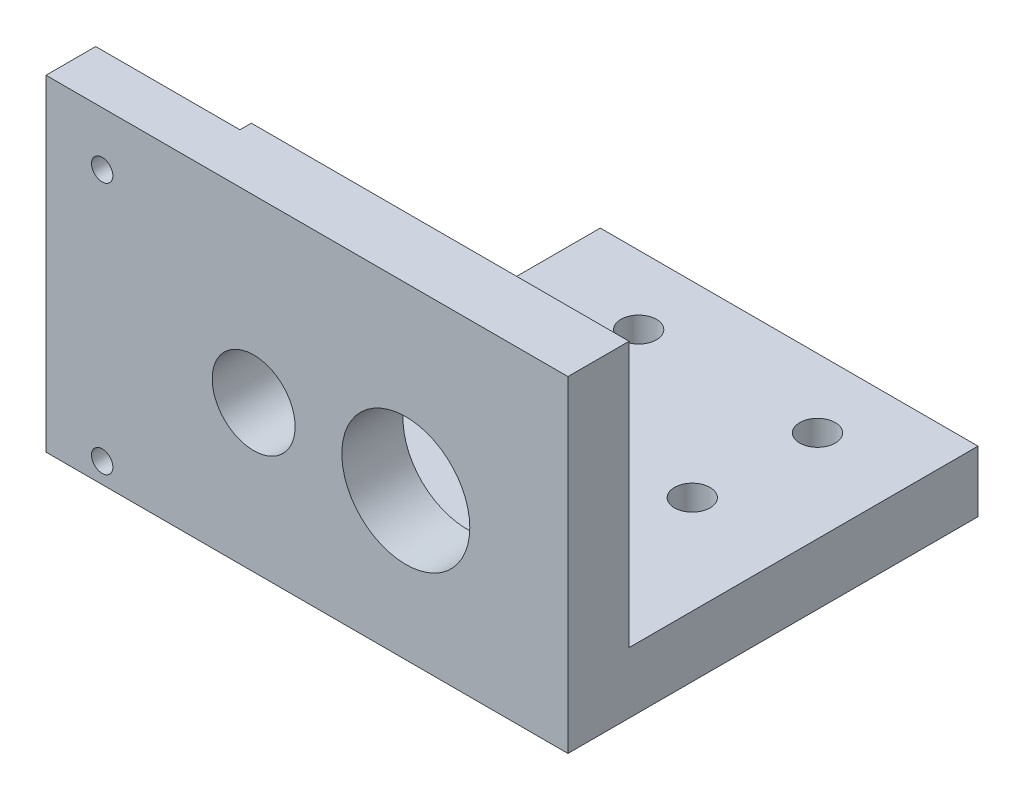
from build123d import *

# Parameters (mm, degrees)
EXTRUDE_THIN1_DEPTH = 36.7
SKETCH4_W           = 21.133468013
SKETCH4_H           = 40.04871341
CUT_EXTRUDE2_DEPTH  = 54.616609778
SKETCH5_R           = 4.5
CUT_EXTRUDE3_DEPTH  = 54.616609778
SKETCH6_R           = 2.915
CUT_EXTRUDE4_DEPTH  = 54.616609778
SKETCH7_R           = 0.75
CUT_EXTRUDE5_DEPTH  = 54.616609778
SKETCH8_R           = 1.25
CUT_EXTRUDE6_DEPTH  = 54.616609778
SKETCH9_W           = 36.7
SKETCH9_H           = 7.475480679
CUT_EXTRUDE7_DEPTH  = 54.616609778


with BuildPart() as part:
    # Sketch3 → Extrude-Thin1 (new body)
    with BuildSketch(Plane(origin=(0, 0, 0), x_dir=(0, 0, -1), z_dir=(1, 0, 0))):
        Polygon((0, 0), (0, -26.128965265), (24.534239686, -26.128965265), (24.534239686, -30.428965265), (-4.3, -30.428965265), (-4.3, 0), align=None)
    extrude(amount=-EXTRUDE_THIN1_DEPTH)

    # Sketch4 → Cut-Extrude2 (cut, through all)
    with BuildSketch(Plane(origin=(0, 0, 0), x_dir=(1, 0, 0), z_dir=(0, 1, 0))):
        with Locations((-37.126734007, 19.219871441)):
            Rectangle(SKETCH4_W, SKETCH4_H)
    extrude(amount=-CUT_EXTRUDE2_DEPTH, mode=Mode.SUBTRACT)

    # Sketch5 → Cut-Extrude3 (cut, through all)
    with BuildSketch(Plane.XY):
        with Locations((-11.4, -20.118965265)):
            Circle(SKETCH5_R)
    extrude(amount=CUT_EXTRUDE3_DEPTH, mode=Mode.SUBTRACT)

    # Sketch6 → Cut-Extrude4 (cut, through all)
    with BuildSketch(Plane.XY):
        with Locations((-22.1, -20.118965265)):
            Circle(SKETCH6_R)
    extrude(amount=CUT_EXTRUDE4_DEPTH, mode=Mode.SUBTRACT)

    # Sketch7 → Cut-Extrude5 (cut, through all)
    with BuildSketch(Plane.XY):
        with Locations((-32.75, -11.248965265)):
            Circle(SKETCH7_R)
        with Locations((-32.75, -28.998965265)):
            Circle(SKETCH7_R)
    extrude(amount=CUT_EXTRUDE5_DEPTH, mode=Mode.SUBTRACT)

    # Sketch8 → Cut-Extrude6 (cut, through all)
    with BuildSketch(Plane(origin=(0, 0, 0), x_dir=(1, 0, 0), z_dir=(0, 1, 0))):
        with Locations(Location((-19.027267825, 11.350303501, 0), (0, 0, 270))):
            Circle(SKETCH8_R)
        with Locations(Location((-19.027267825, 19.701887491, 0), (0, 0, 270))):
            Circle(SKETCH8_R)
        with Locations(Location((-6.907228252, 11.350303501, 0), (0, 0, 270))):
            Circle(SKETCH8_R)
        with Locations(Location((-6.45179676, 19.701887491, 0), (0, 0, 270))):
            Circle(SKETCH8_R)
    extrude(amount=-CUT_EXTRUDE6_DEPTH, mode=Mode.SUBTRACT)

    # Sketch9 → Cut-Extrude7 (cut, through all)
    with BuildSketch(Plane.XY):
        with Locations((-18.35, -3.73774034)):
            Rectangle(SKETCH9_W, SKETCH9_H)
    extrude(amount=CUT_EXTRUDE7_DEPTH, mode=Mode.SUBTRACT)


solid = part.part
